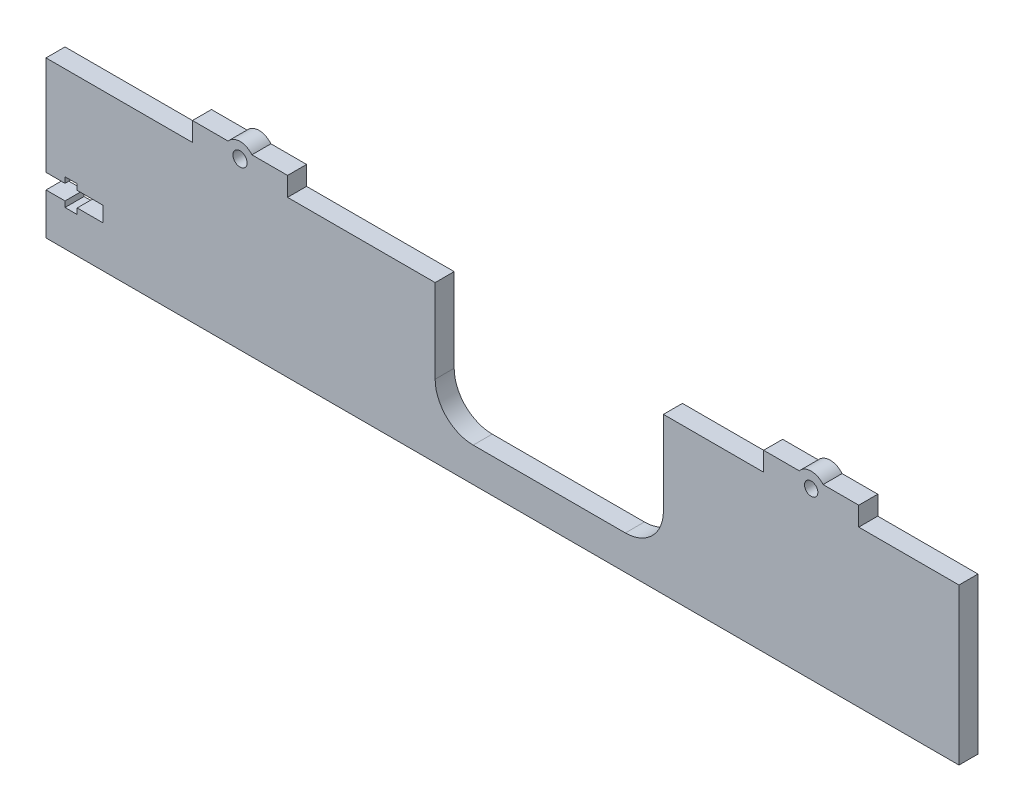
from build123d import *

# Parameters (mm, degrees)
SKETCH1_W           = 240
SKETCH1_H           = 51
BOSS_EXTRUDE1_DEPTH = 5
SKETCH4_W           = 25
SKETCH4_H           = 5
BOSS_EXTRUDE2_DEPTH = 5
CUT_EXTRUDE1_DEPTH  = 10
CUT_EXTRUDE4_DEPTH  = 10
SKETCH15_W          = 25
SKETCH15_H          = 5
BOSS_EXTRUDE4_DEPTH = 5
SKETCH17_R          = 1.863928877
SKETCH17_R_2        = 1.748329033
CUT_EXTRUDE5_DEPTH  = 10
SKETCH18_R          = 4
SKETCH18_R_2        = 1.748329033
SKETCH18_R_3        = 1.863928877
BOSS_EXTRUDE5_DEPTH = 5
SKETCH19_W          = 240
SKETCH19_H          = 10
CUT_EXTRUDE6_DEPTH  = 10


with BuildPart() as part:
    # Sketch1 → Boss-Extrude1 (new body)
    with BuildSketch(Plane.XY):
        Rectangle(SKETCH1_W, SKETCH1_H)
    extrude(amount=BOSS_EXTRUDE1_DEPTH)

    # Sketch4 → Boss-Extrude2 (add)
    with BuildSketch(Plane.XY.offset(5)):
        with Locations((-69, 28)):
            Rectangle(SKETCH4_W, SKETCH4_H)
    extrude(amount=-BOSS_EXTRUDE2_DEPTH)

    # Sketch6 → Cut-Extrude1 (cut)
    with BuildSketch(Plane.XY.offset(5)):
        Polygon((-115, -4.562158061), (-120, -4.562158061), (-120, -0.562158061), (-115, -0.562158061), (-115, 0.937841939), (-111.8, 0.937841939), (-111.8, -0.562158061), (-105, -0.562158061), (-105, -4.562158061), (-111.8, -4.562158061), (-111.8, -6.062158061), (-115, -6.062158061), align=None)
    extrude(amount=-CUT_EXTRUDE1_DEPTH, mode=Mode.SUBTRACT)

    # Sketch14 → Cut-Extrude4 (cut)
    with BuildSketch(Plane.XY.offset(5)):
        with BuildLine():
            Line((-17.7, 25.5), (42.3, 25.5))
            Line((42.3, 25.5), (42.3, 3.5))
            ThreePointArc((42.3, 3.5), (39.371067812, -3.571067812), (32.3, -6.5))
            Line((32.3, -6.5), (-7.7, -6.5))
            ThreePointArc((-7.7, -6.5), (-14.771067812, -3.571067812), (-17.7, 3.5))
            Line((-17.7, 3.5), (-17.7, 25.5))
        make_face()
    extrude(amount=-CUT_EXTRUDE4_DEPTH, mode=Mode.SUBTRACT)

    # Sketch15 → Boss-Extrude4 (add)
    with BuildSketch(Plane.XY.offset(5)):
        with Locations((81.15, 28)):
            Rectangle(SKETCH15_W, SKETCH15_H)
    extrude(amount=-BOSS_EXTRUDE4_DEPTH)

    # Sketch17 → Cut-Extrude5 (cut)
    with BuildSketch(Plane.XY.offset(5)):
        with Locations((-69, 28)):
            Circle(SKETCH17_R)
        with Locations((81.151489704, 28)):
            Circle(SKETCH17_R_2)
    extrude(amount=-CUT_EXTRUDE5_DEPTH, mode=Mode.SUBTRACT)

    # Sketch18 → Boss-Extrude5 (add)
    # profile 1 of 2: a face of its own
    with BuildSketch(Plane.XY.offset(5)):
        with Locations((81.151489704, 28)):
            Circle(SKETCH18_R)
        with Locations((81.151489704, 28)):
            Circle(SKETCH18_R_2, mode=Mode.SUBTRACT)
    # profile 2 of 2: a face of its own
    with BuildSketch(Plane.XY.offset(5)):
        with Locations((-69, 28)):
            Circle(SKETCH18_R)
        with Locations((-69, 28)):
            Circle(SKETCH18_R_3, mode=Mode.SUBTRACT)
    extrude(amount=-BOSS_EXTRUDE5_DEPTH)

    # Sketch19 → Cut-Extrude6 (cut)
    with BuildSketch(Plane.XY.offset(5)):
        with Locations((0, -20.5)):
            Rectangle(SKETCH19_W, SKETCH19_H)
    extrude(amount=-CUT_EXTRUDE6_DEPTH, mode=Mode.SUBTRACT)


solid = part.part
